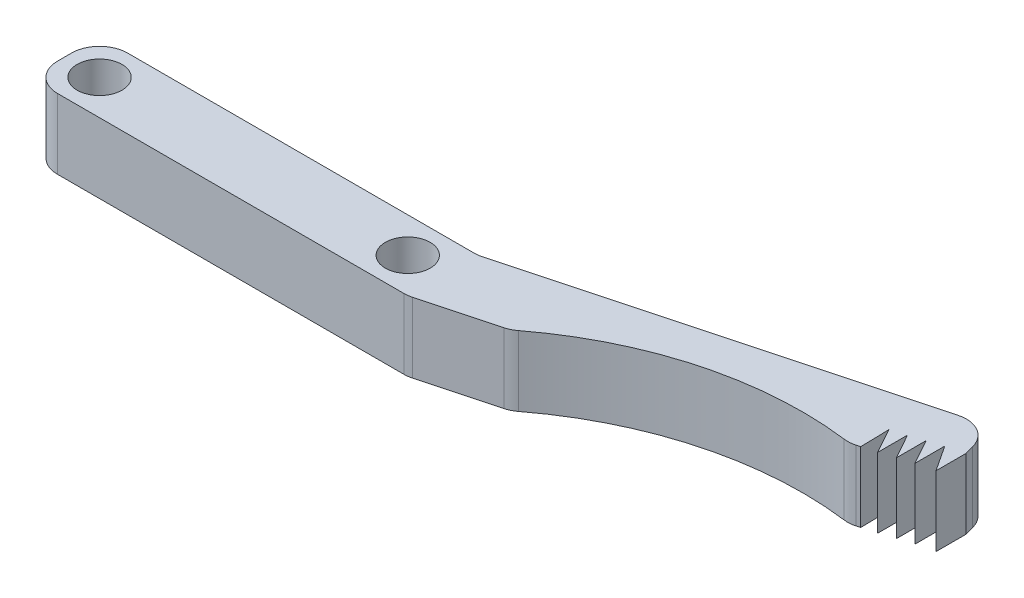
from build123d import *

# Parameters (mm, degrees)
SKETCH_1_R      = 1.6
EXTRUDE_1_DEPTH = 5
FILLET_1_R      = 2


with BuildPart() as part:
    # 草图1 → 凸台-拉伸1 (new body)
    with BuildSketch(Plane(origin=(0, 0, 0), x_dir=(1, 0, 0), z_dir=(0, 1, 0))):
        with BuildLine():
            Line((-13.5, 2.5), (13.5, 2.5))
            Line((13.5, 2.5), (42.477774789, 10.264571353))
            Line((42.477774789, 10.264571353), (43.176188432, 7.65805615))
            Line((43.176188432, 7.65805615), (43.176188432, 5.529700605))
            Line((43.176188432, 5.529700605), (41.964432742, 7.37098368))
            Line((41.964432742, 7.37098368), (41.964432742, 5.242628135))
            Line((41.964432742, 5.242628135), (40.960741016, 7.044242108))
            Line((40.960741016, 7.044242108), (40.960741016, 4.915886563))
            Line((40.960741016, 4.915886563), (39.95704929, 6.717500536))
            Line((39.95704929, 6.717500536), (39.95704929, 4.589144991))
            Line((39.95704929, 4.589144991), (38.953357563, 6.390758965))
            Line((38.953357563, 6.390758965), (39.000927635, 4.332952966))
            Line((39.000927635, 4.332952966), (38.334050279, 4.154263717))
            ThreePointArc((38.334050279, 4.154263717), (28.290848144, 3.559013712), (19.295554958, -0.947085729))
            Line((19.295554958, -0.947085729), (13.5, -2.5))
            Line((13.5, -2.5), (-13.5, -2.5))
            Line((-13.5, -2.5), (-13.5, 2.5))
        make_face()
        with Locations(Location((-11, 0, 0), (0, 0, 270))):
            Circle(SKETCH_1_R, mode=Mode.SUBTRACT)
        with Locations(Location((11, 0, 0), (0, 0, 90))):
            Circle(SKETCH_1_R, mode=Mode.SUBTRACT)
    extrude(amount=EXTRUDE_1_DEPTH)

    # 圆角1
    fillet_1_edges = [part.edges().sort_by_distance(p)[0] for p in [
        (13.5, 2.5, 2.5),
        (-13.5, 2.5, 2.5),
        (-13.5, 2.5, -2.5),
        (13.5, 2.5, -2.5),
        (42.477774789, 2.5, -10.264571353),
        (38.334050279, 2.5, -4.154263717),
        (19.295554958, 2.5, 0.947085729),
    ]]
    fillet(fillet_1_edges, radius=FILLET_1_R)


solid = part.part
